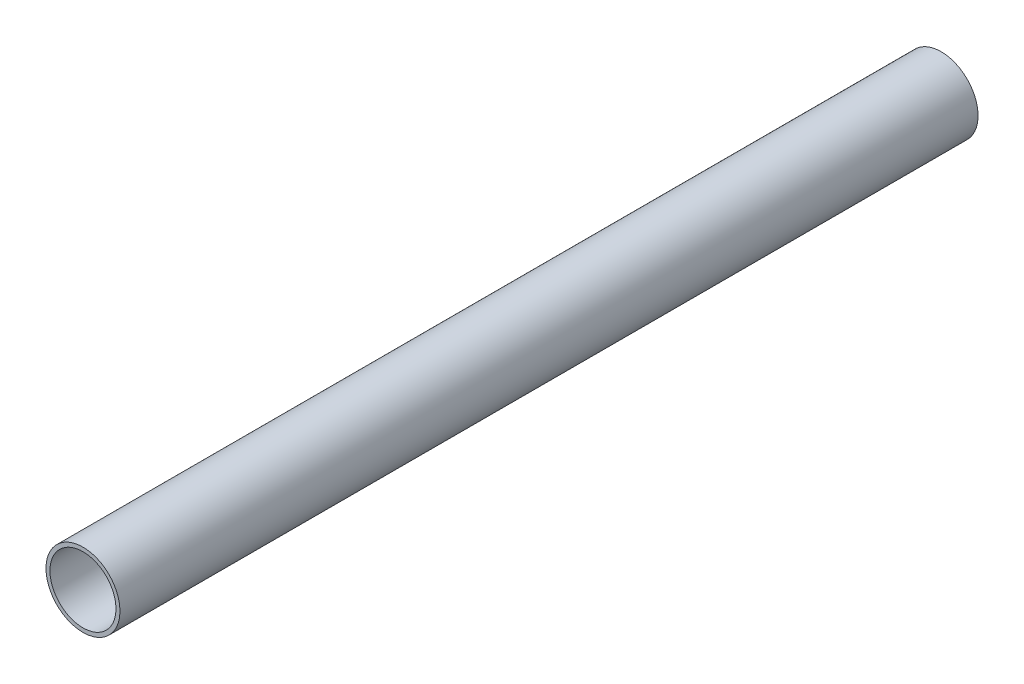
from build123d import *

# Parameters (mm, degrees)
SKETCH1_R           = 14
SKETCH1_R_2         = 12.5
BOSS_EXTRUDE1_DEPTH = 325


with BuildPart() as part:
    # Sketch1 → Boss-Extrude1 (new body)
    with BuildSketch(Plane(origin=(0, 0, -75), x_dir=(-1, 0, 0), z_dir=(0, 0, -1))):
        with Locations((0, 97.5)):
            Circle(SKETCH1_R)
        with Locations((0, 97.5)):
            Circle(SKETCH1_R_2, mode=Mode.SUBTRACT)
    extrude(amount=BOSS_EXTRUDE1_DEPTH)


solid = part.part
